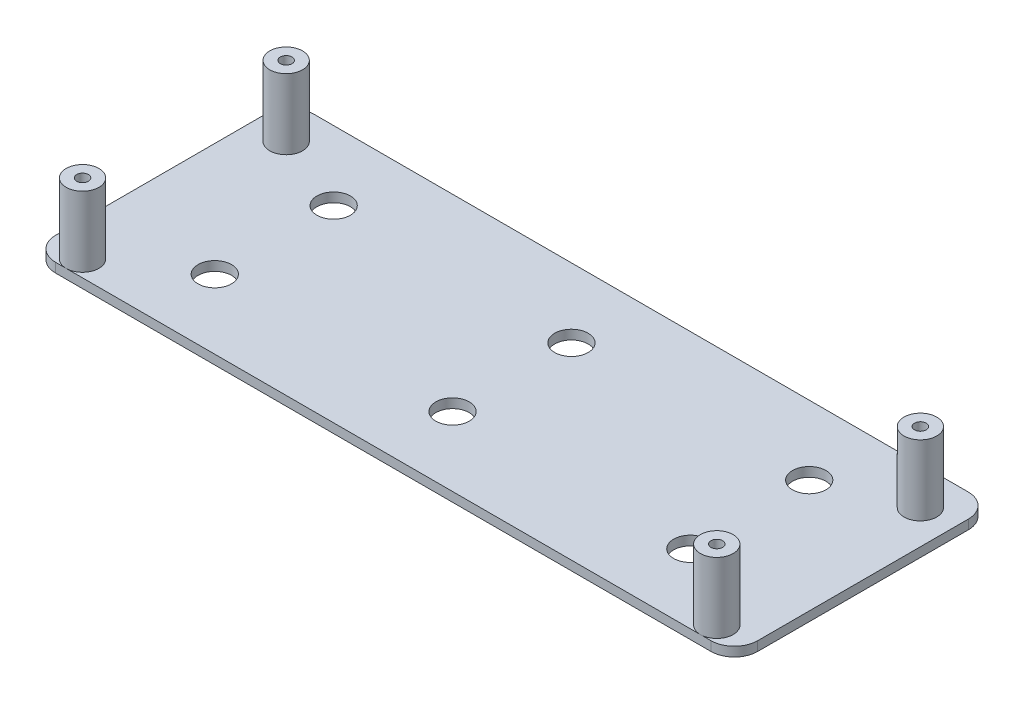
from build123d import *

# Parameters (mm, degrees)
SKETCH1_W               = 150
SKETCH1_H               = 55
BOSS_EXTRUDE1_DEPTH     = 2
SKETCH2_R               = 3.5
BOSS_EXTRUDE2_DEPTH     = 15
CUT_EXTRUDE1_REACH      = 83.672
SKETCH3_R               = 1.25
FILLET1_R               = 5
F_1_4_CLEARANCE_HOLE1_D = 7.14248
SKETCH8_R               = 2.1
CUT_EXTRUDE2_DEPTH      = 10


with BuildPart() as part:
    # Sketch1 → Boss-Extrude1 (new body)
    with BuildSketch(Plane(origin=(0, 0, 0), x_dir=(1, 0, 0), z_dir=(0, 1, 0))):
        Rectangle(SKETCH1_W, SKETCH1_H)
    extrude(amount=BOSS_EXTRUDE1_DEPTH)

    # Sketch2 → Boss-Extrude2 (add)
    with BuildSketch(Plane(origin=(0, 2, 0), x_dir=(1, 0, 0), z_dir=(0, 1, 0))):
        with Locations(Location((-67.75, -24, 0), (0, 0, 270))):
            Circle(SKETCH2_R)
        with Locations(Location((-67.75, 19.5, 0), (0, 0, 90))):
            Circle(SKETCH2_R)
        with Locations(Location((67.75, 19.5, 0), (0, 0, 90))):
            Circle(SKETCH2_R)
        with Locations(Location((67.75, -24, 0), (0, 0, 270))):
            Circle(SKETCH2_R)
    extrude(amount=BOSS_EXTRUDE2_DEPTH)

    # Sketch3 → Cut-Extrude1 (cut, up to next)
    with BuildSketch(Plane(origin=(0, 17, 0), x_dir=(1, 0, 0), z_dir=(0, 1, 0)), mode=Mode.PRIVATE) as cut_extrude1_sk1:
        with Locations(Location((-67.75, -24, 0), (0, 0, 270))):
            Circle(SKETCH3_R)
    cut_extrude1_tool1 = extrude(cut_extrude1_sk1.sketch, amount=-CUT_EXTRUDE1_REACH, mode=Mode.PRIVATE) & part.part
    # Sketch3 → Cut-Extrude1 (cut, up to next)
    with BuildSketch(Plane(origin=(0, 17, 0), x_dir=(1, 0, 0), z_dir=(0, 1, 0)), mode=Mode.PRIVATE) as cut_extrude1_sk2:
        with Locations(Location((-67.75, 19.5, 0), (0, 0, 270))):
            Circle(SKETCH3_R)
    cut_extrude1_tool2 = extrude(cut_extrude1_sk2.sketch, amount=-CUT_EXTRUDE1_REACH, mode=Mode.PRIVATE) & part.part
    # Sketch3 → Cut-Extrude1 (cut, up to next)
    with BuildSketch(Plane(origin=(0, 17, 0), x_dir=(1, 0, 0), z_dir=(0, 1, 0)), mode=Mode.PRIVATE) as cut_extrude1_sk3:
        with Locations(Location((67.75, 19.5, 0), (0, 0, 270))):
            Circle(SKETCH3_R)
    cut_extrude1_tool3 = extrude(cut_extrude1_sk3.sketch, amount=-CUT_EXTRUDE1_REACH, mode=Mode.PRIVATE) & part.part
    # Sketch3 → Cut-Extrude1 (cut, up to next)
    with BuildSketch(Plane(origin=(0, 17, 0), x_dir=(1, 0, 0), z_dir=(0, 1, 0)), mode=Mode.PRIVATE) as cut_extrude1_sk4:
        with Locations(Location((67.75, -24, 0), (0, 0, 270))):
            Circle(SKETCH3_R)
    cut_extrude1_tool4 = extrude(cut_extrude1_sk4.sketch, amount=-CUT_EXTRUDE1_REACH, mode=Mode.PRIVATE) & part.part
    add(cut_extrude1_tool1.solids().sort_by_distance((-67.75, 17, 24))[0], mode=Mode.SUBTRACT)
    add(cut_extrude1_tool2.solids().sort_by_distance((-67.75, 17, -19.5))[0], mode=Mode.SUBTRACT)
    add(cut_extrude1_tool3.solids().sort_by_distance((67.75, 17, -19.5))[0], mode=Mode.SUBTRACT)
    add(cut_extrude1_tool4.solids().sort_by_distance((67.75, 17, 24))[0], mode=Mode.SUBTRACT)

    # Fillet1
    fillet1_edges = [part.edges().sort_by_distance(p)[0] for p in [
        (75, 1, 27.5),
        (-75, 1, 27.5),
        (-75, 1, -27.5),
        (75, 1, -27.5),
    ]]
    fillet(fillet1_edges, radius=FILLET1_R)

    # 1/4 Clearance Hole1 (through all)
    with Locations(Plane(origin=(0, 2, 0), x_dir=(1, 0, 0), z_dir=(0, 1, 0))):
        with Locations((-50.8, 12.7), (50.8, 12.7), (50.8, -12.7), (-50.8, -12.7), (0, -12.7), (0, 12.7)):
            Hole(F_1_4_CLEARANCE_HOLE1_D / 2)

    # Sketch8 → Cut-Extrude2 (cut)
    with BuildSketch(Plane.XZ):
        with Locations(Location((-67.75, 24, 0), (0, 0, 270))):
            Circle(SKETCH8_R)
        with Locations(Location((-67.75, -19.5, 0), (0, 0, 270))):
            Circle(SKETCH8_R)
        with Locations(Location((67.75, -19.5, 0), (0, 0, 270))):
            Circle(SKETCH8_R)
        with Locations(Location((67.75, 24, 0), (0, 0, 270))):
            Circle(SKETCH8_R)
    extrude(amount=-CUT_EXTRUDE2_DEPTH, mode=Mode.SUBTRACT)


solid = part.part
